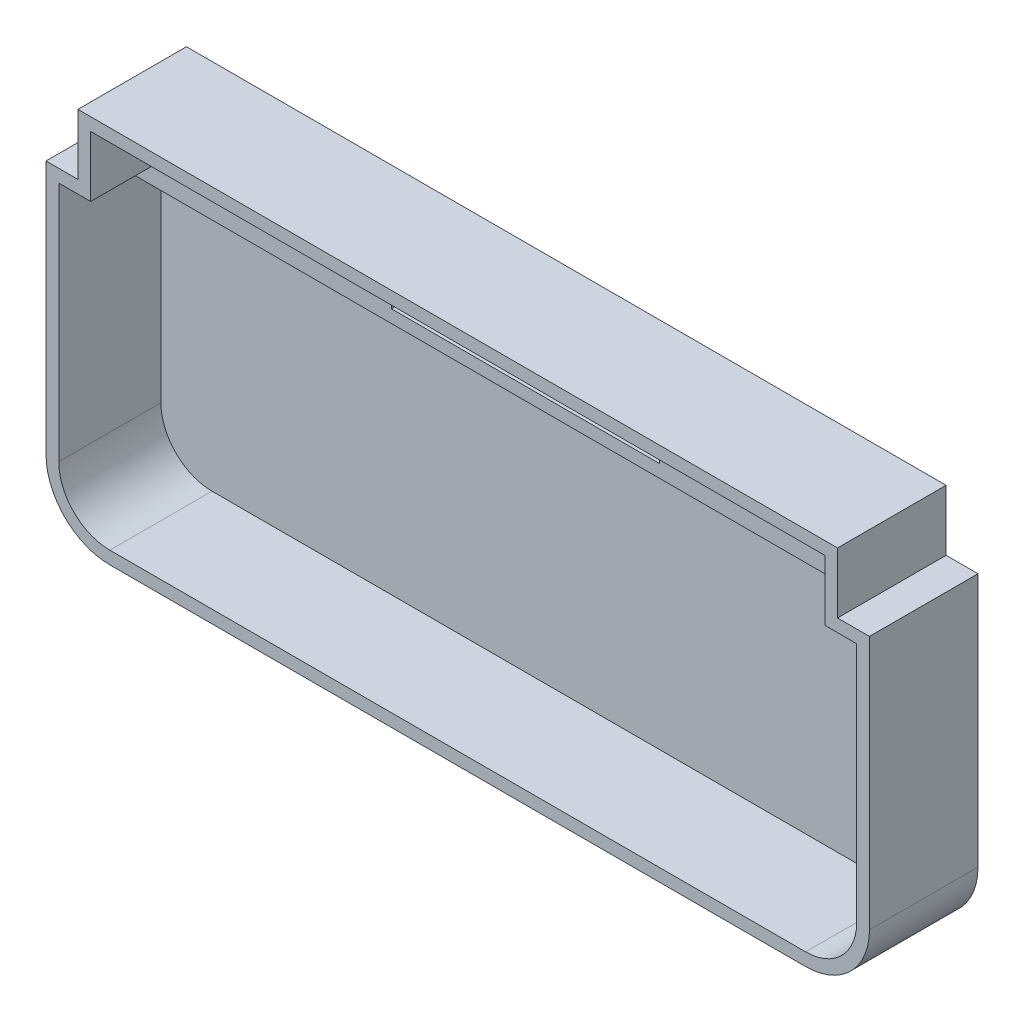
from build123d import *

# Parameters (mm, degrees)
BOSS_EXTRUDE1_DEPTH = 1
FILLET1_R           = 10
BOSS_EXTRUDE2_START = 16
BOSS_EXTRUDE2_DEPTH = 16
BOSS_EXTRUDE3_DEPTH = 5.5


with BuildPart() as part:
    # Sketch1 → Boss-Extrude1 (new body)
    with BuildSketch(Plane.XY):
        Polygon((-59.5, 15), (59.5, 15), (59.5, 5.5), (64.5, 5.5), (64.5, -44.3), (-64.5, -44.3), (-64.5, 5.5), (-59.5, 5.5), align=None)
    extrude(amount=BOSS_EXTRUDE1_DEPTH)

    # Fillet1
    fillet1_edges = [part.edges().sort_by_distance(p)[0] for p in [
        (64.5, -44.3, 0.5),
        (-64.5, -44.3, 0.5),
    ]]
    fillet(fillet1_edges, radius=FILLET1_R)

    # Sketch2 → Boss-Extrude2 (add)
    with BuildSketch(Plane.XY.offset(1).offset(BOSS_EXTRUDE2_START)):
        with BuildLine():
            Line((59.5, 5.5), (59.5, 15))
            Line((59.5, 15), (-59.5, 15))
            Line((-59.5, 15), (-59.5, 5.5))
            Line((-59.5, 5.5), (-64.5, 5.5))
            Line((-64.5, 5.5), (-64.5, -34.3))
            ThreePointArc((-64.5, -34.3), (-61.571067812, -41.371067812), (-54.5, -44.3))
            Line((-54.5, -44.3), (54.5, -44.3))
            ThreePointArc((54.5, -44.3), (61.571067812, -41.371067812), (64.5, -34.3))
            Line((64.5, -34.3), (64.5, 5.5))
            Line((64.5, 5.5), (59.5, 5.5))
        make_face()
        with BuildLine():
            Line((-54.5, -42.3), (54.5, -42.3))
            ThreePointArc((54.5, -42.3), (60.156854249, -39.956854249), (62.5, -34.3))
            Line((62.5, -34.3), (62.5, 3.5))
            Line((62.5, 3.5), (57.5, 3.5))
            Line((57.5, 3.5), (57.5, 13))
            Line((57.5, 13), (-57.5, 13))
            Line((-57.5, 13), (-57.5, 3.5))
            Line((-57.5, 3.5), (-62.5, 3.5))
            Line((-62.5, 3.5), (-62.5, -34.3))
            ThreePointArc((-62.5, -34.3), (-60.156854249, -39.956854249), (-54.5, -42.3))
        make_face(mode=Mode.SUBTRACT)
    extrude(amount=-BOSS_EXTRUDE2_DEPTH)

    # Sketch3 → Boss-Extrude3 (add)
    with BuildSketch(Plane.XY.offset(1)):
        Polygon((-20.877513704, 2), (21.122486296, 2), (21.122486296, 13), (57.5, 13), (57.5, 3.5), (62.5, 3.5), (62.5, 0), (-62.5, 0), (-62.5, 3.5), (-57.5, 3.5), (-57.5, 13), (-20.877513704, 13), align=None)
    extrude(amount=BOSS_EXTRUDE3_DEPTH)


solid = part.part
